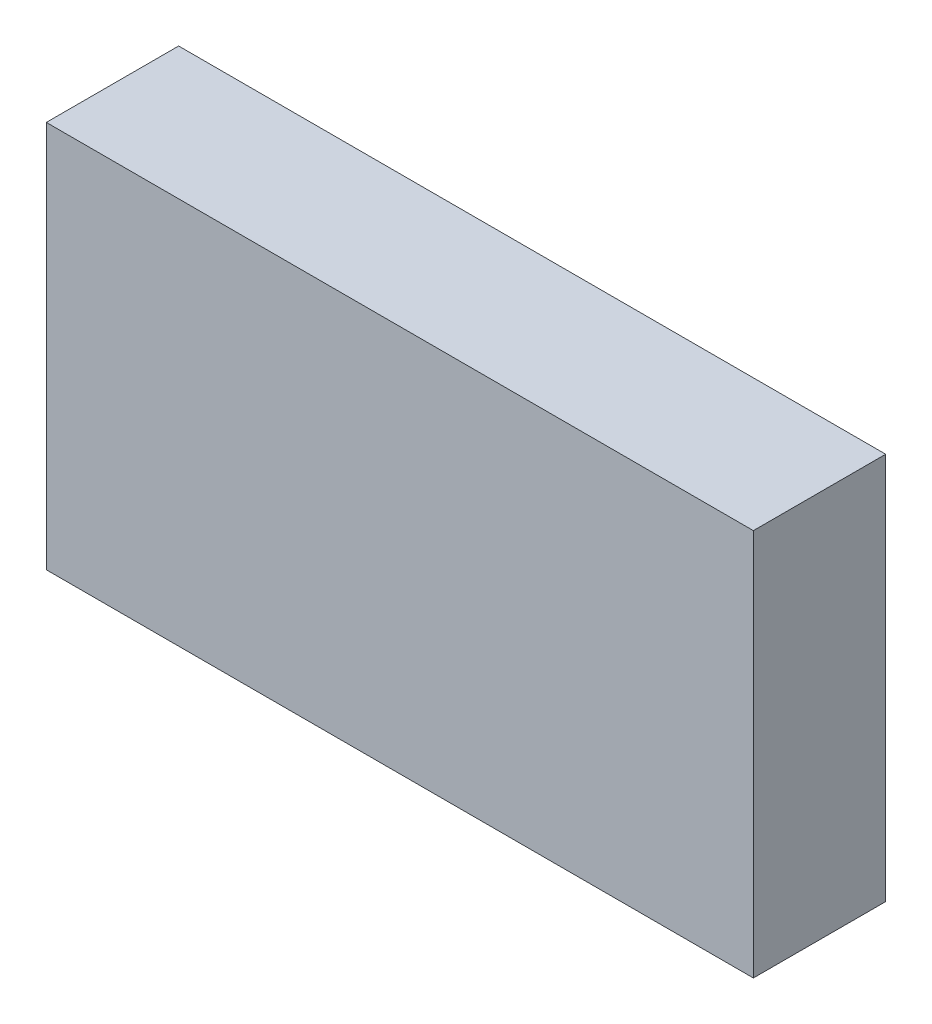
from build123d import *

# Parameters (mm, degrees)
CURVEBOSS_DEPTH      = 2.317
CURVEBOSS_DEPTH_BACK = 3.619
CURVESKETCH_W        = 31.719
CURVESKETCH_H        = 17.381


with BuildPart() as part:
    # CurveSketch → CurveBoss (new, two sides: drawn at the far end of the back side and taken through both)
    with BuildSketch(Plane.XY.offset(-CURVEBOSS_DEPTH_BACK)):
        with Locations((-4.193, 6.827)):
            Rectangle(CURVESKETCH_W, CURVESKETCH_H)
    extrude(amount=CURVEBOSS_DEPTH + CURVEBOSS_DEPTH_BACK)


solid = part.part
